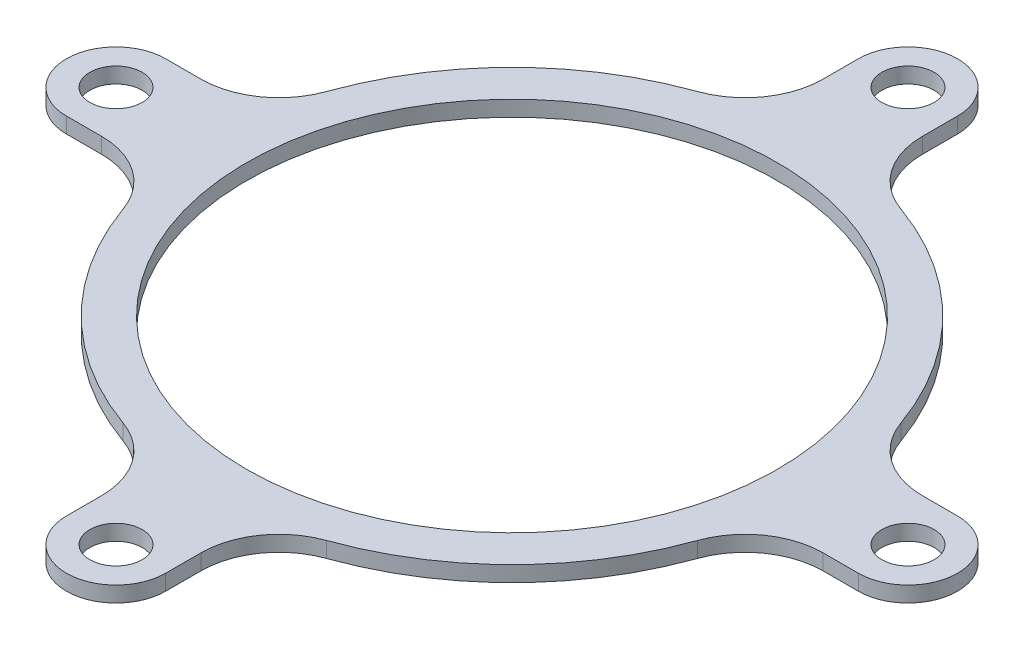
from build123d import *

# Parameters (mm, degrees)
SKETCH1_R           = 39
SKETCH1_R_2         = 34
BOSS_EXTRUDE1_DEPTH = 1
SKETCH2_R           = 3.35
BOSS_EXTRUDE2_DEPTH = 2
CIRPATTERN1_COUNT   = 4


with BuildPart() as part:
    # Sketch1 → Boss-Extrude1 (new, symmetric)
    with BuildSketch(Plane(origin=(0, 0, 0), x_dir=(1, 0, 0), z_dir=(0, 1, 0))):
        with Locations(Location((0, 0, 0), (0, 0, 270))):
            Circle(SKETCH1_R)
        with Locations(Location((0, 0, 0), (0, 0, 270))):
            Circle(SKETCH1_R_2, mode=Mode.SUBTRACT)
    extrude(amount=BOSS_EXTRUDE1_DEPTH, both=True)

    # Sketch2 → Boss-Extrude2 (add)
    with BuildSketch(Plane(origin=(0, 1, 0), x_dir=(1, 0, 0), z_dir=(0, 1, 0))):
        with BuildLine():
            Line((-6.35, 46.191747098), (-6.35, 50.7))
            ThreePointArc((-6.35, 50.7), (0, 57.05), (6.35, 50.7))
            Line((6.35, 50.7), (6.35, 46.191747098))
            ThreePointArc((6.35, 46.191747098), (8.183992807, 40.419717427), (13.013265306, 36.764859935))
            ThreePointArc((13.013265306, 36.764859935), (0, 39), (-13.013265306, 36.764859935))
            ThreePointArc((-13.013265306, 36.764859935), (-8.183992807, 40.419717427), (-6.35, 46.191747098))
        make_face()
        with Locations(Location((0, 50.7, 0), (0, 0, 270))):
            Circle(SKETCH2_R, mode=Mode.SUBTRACT)
    boss_extrude2 = extrude(amount=-BOSS_EXTRUDE2_DEPTH)

    # CirPattern1: Boss-Extrude2 ×4 about axis
    cirpattern1_axis = Axis((0, 0, 0), (0, 1, 0))
    for i in range(1, CIRPATTERN1_COUNT):
        add(boss_extrude2.rotate(cirpattern1_axis, i * 360 / CIRPATTERN1_COUNT))


solid = part.part
